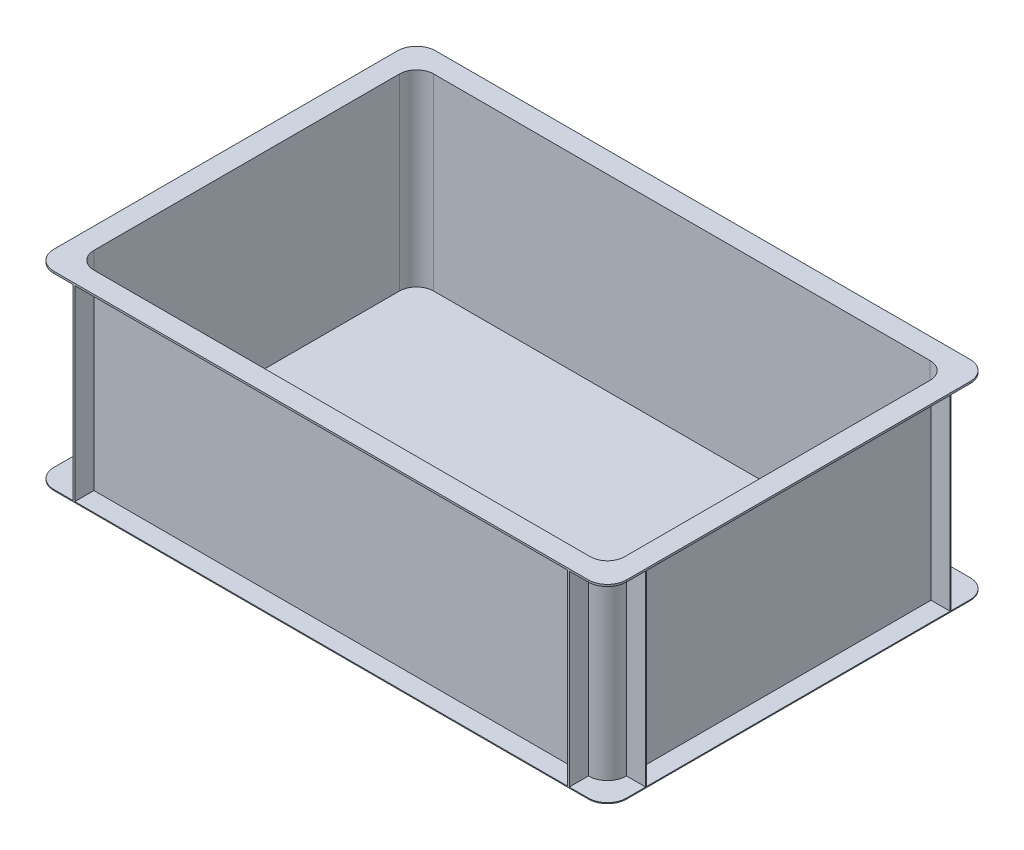
from build123d import *

# Parameters (mm, degrees)
BOSS_EXTRU_4_DEPTH        = 1
BOSS_EXTRU_5_DEPTH        = 198
COQUE2_T                  = -2
BOSS_EXTRU_6_DEPTH        = 2
ENL_V_START               = -2
ENL_V_MAT_EXTRU_3_DEPTH   = 2
ESQUISSE18_W              = 1
ESQUISSE18_H              = 196
BOSS_EXTRU_7_DEPTH        = 20
SYM_TRIE3_COPY_1_SKETCH_W = 1
SYM_TRIE3_COPY_1_SKETCH_H = 196
SYM_TRIE3_COPY_1_DEPTH    = 20
ESQUISSE19_W              = 2
ESQUISSE19_H              = 196
BOSS_EXTRU_8_DEPTH        = 20
SYM_TRIE5_COPY_1_SKETCH_W = 2
SYM_TRIE5_COPY_1_SKETCH_H = 196
SYM_TRIE5_COPY_1_DEPTH    = 20


with BuildPart() as part:
    # Esquisse1 → Boss.-Extru.4 (new body)
    with BuildSketch(Plane(origin=(0, 0, 0), x_dir=(1, 0, 0), z_dir=(0, 1, 0))):
        with BuildLine():
            Line((-280, 200), (280, 200))
            ThreePointArc((280, 200), (294.142135624, 194.142135624), (300, 180))
            Line((300, 180), (300, -180))
            ThreePointArc((300, -180), (294.142135624, -194.142135624), (280, -200))
            Line((280, -200), (-280, -200))
            ThreePointArc((-280, -200), (-294.142135624, -194.142135624), (-300, -180))
            Line((-300, -180), (-300, 180))
            ThreePointArc((-300, 180), (-294.142135624, 194.142135624), (-280, 200))
        make_face()
    boss_extru_4 = extrude(amount=BOSS_EXTRU_4_DEPTH)

    # Esquisse3 → Boss.-Extru.5 (add)
    with BuildSketch(Plane(origin=(0, 1, 0), x_dir=(1, 0, 0), z_dir=(0, 1, 0))):
        with BuildLine():
            Line((-260, 180), (260, 180))
            ThreePointArc((260, 180), (274.142135624, 174.142135624), (280, 160))
            Line((280, 160), (280, -160))
            ThreePointArc((280, -160), (274.142135624, -174.142135624), (260, -180))
            Line((260, -180), (-260, -180))
            ThreePointArc((-260, -180), (-274.142135624, -174.142135624), (-280, -160))
            Line((-280, -160), (-280, 160))
            ThreePointArc((-280, 160), (-274.142135624, 174.142135624), (-260, 180))
        make_face()
    extrude(amount=BOSS_EXTRU_5_DEPTH)

    # Coque2
    coque2_openings = [part.faces().sort_by_distance(p)[0] for p in [
        (0, 199, 0),
    ]]
    offset(amount=COQUE2_T, openings=coque2_openings, kind=Kind.INTERSECTION)



with BuildPart() as body_2:
    # Esquisse12 → Boss.-Extru.6 (new body)
    with BuildSketch(Plane(origin=(0, 197, 0), x_dir=(1, 0, 0), z_dir=(0, 1, 0))):
        with BuildLine():
            Line((-280, 200), (280, 200))
            ThreePointArc((280, 200), (294.142135624, 194.142135624), (300, 180))
            Line((300, 180), (300, -180))
            ThreePointArc((300, -180), (294.142135624, -194.142135624), (280, -200))
            Line((280, -200), (-280, -200))
            ThreePointArc((-280, -200), (-294.142135624, -194.142135624), (-300, -180))
            Line((-300, -180), (-300, 180))
            ThreePointArc((-300, 180), (-294.142135624, 194.142135624), (-280, 200))
        make_face()
    extrude(amount=BOSS_EXTRU_6_DEPTH)

    # Esquisse17 → Enlèv. mat.-Extru.3 (cut)
    with BuildSketch(Plane(origin=(0, 199, 0), x_dir=(1, 0, 0), z_dir=(0, 1, 0)).offset(ENL_V_START)):
        with BuildLine():
            Line((-260, 180), (260, 180))
            ThreePointArc((260, 180), (274.142135624, 174.142135624), (280, 160))
            Line((280, 160), (280, -160))
            ThreePointArc((280, -160), (274.142135624, -174.142135624), (260, -180))
            Line((260, -180), (-260, -180))
            ThreePointArc((-260, -180), (-274.142135624, -174.142135624), (-280, -160))
            Line((-280, -160), (-280, 160))
            ThreePointArc((-280, 160), (-274.142135624, 174.142135624), (-260, 180))
        make_face()
    extrude(amount=ENL_V_MAT_EXTRU_3_DEPTH, mode=Mode.SUBTRACT)


with BuildPart() as part_1:
    add(part.part)

    add(body_2.part)  # Boss.-Extru.7 merges body 2
    # Esquisse18 → Boss.-Extru.7 (add)
    with BuildSketch(Plane(origin=(280, 0, 0), x_dir=(0, 0, -1), z_dir=(1, 0, 0))):
        with Locations((-159.5, 99)):
            Rectangle(ESQUISSE18_W, ESQUISSE18_H)
    boss_extru_7 = extrude(amount=BOSS_EXTRU_7_DEPTH)


with BuildPart() as sym_trie1_1:
    # Symétrie1: Boss.-Extru.4 across plane
    add(boss_extru_4.mirror(Plane.XY))


with BuildPart() as part_2:
    add(part_1.part)

    # Symétrie1 united with what the copies to: union Symétrie1_1
    add(sym_trie1_1.part)

    # Symétrie2: Boss.-Extru.7 across plane
    add(boss_extru_7.mirror(Plane.XY))

    # Symétrie3: Boss.-Extru.7 across plane
    add(boss_extru_7.mirror(Plane(origin=(0, 0, 0), x_dir=(0, 0, 1), z_dir=(1, 0, 0))))

    # Symétrie3 copy 1 sketch → Symétrie3 copy 1 (add)
    with BuildSketch(Plane.ZY.offset(280)):
        with Locations((-159.5, 99)):
            Rectangle(SYM_TRIE3_COPY_1_SKETCH_W, SYM_TRIE3_COPY_1_SKETCH_H)
    extrude(amount=SYM_TRIE3_COPY_1_DEPTH)

    # Esquisse19 → Boss.-Extru.8 (add)
    with BuildSketch(Plane.XY.offset(180)):
        with Locations((-259, 99)):
            Rectangle(ESQUISSE19_W, ESQUISSE19_H)
    boss_extru_8 = extrude(amount=BOSS_EXTRU_8_DEPTH)

    # Symétrie4: Boss.-Extru.8 across plane
    add(boss_extru_8.mirror(Plane(origin=(0, 0, 0), x_dir=(0, 0, 1), z_dir=(1, 0, 0))))

    # Symétrie5: Boss.-Extru.8 across plane
    add(boss_extru_8.mirror(Plane.XY))

    # Symétrie5 copy 1 sketch → Symétrie5 copy 1 (add)
    with BuildSketch(Plane(origin=(0, 0, -180), x_dir=(-1, 0, 0), z_dir=(0, 0, -1))):
        with Locations((-259, 99)):
            Rectangle(SYM_TRIE5_COPY_1_SKETCH_W, SYM_TRIE5_COPY_1_SKETCH_H)
    extrude(amount=SYM_TRIE5_COPY_1_DEPTH)


solid = part_2.part
